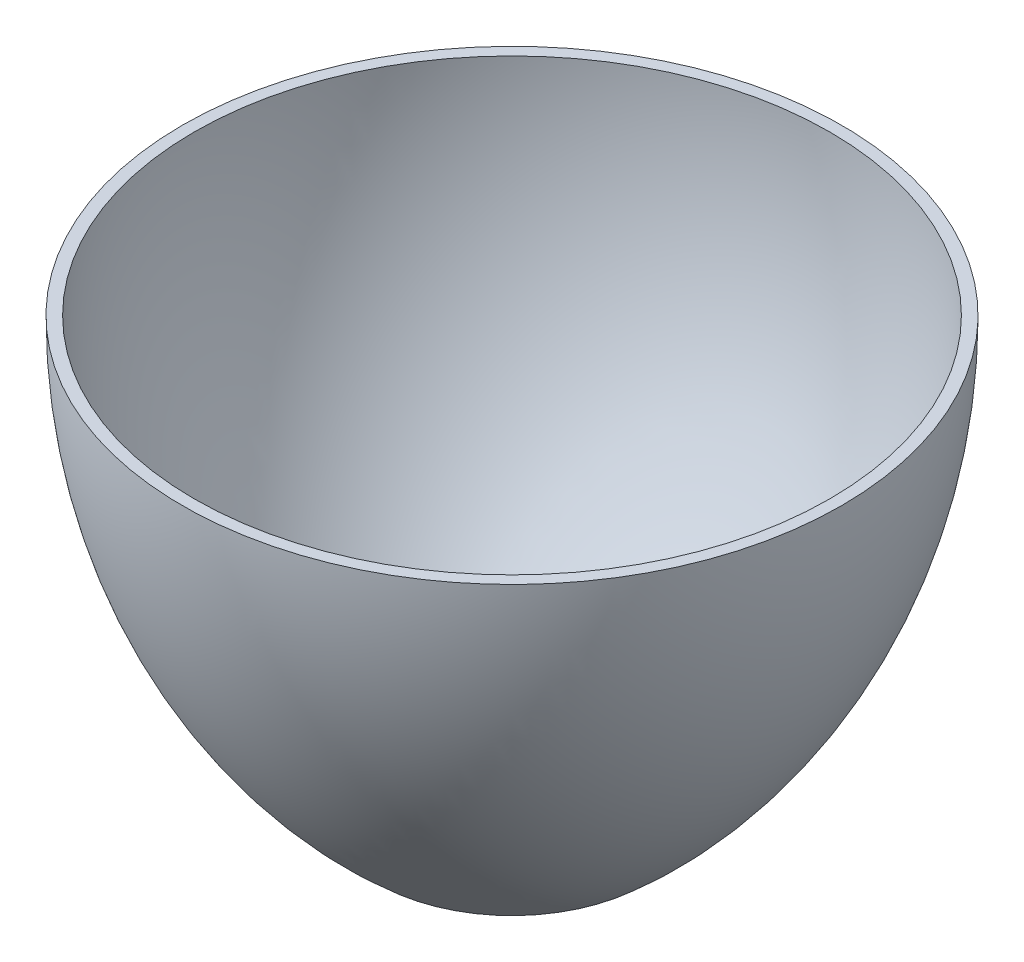
from build123d import *

# Parameters (mm, degrees)
SHELL1_T = 3.175


with BuildPart() as part:
    # Sketch1 → Revolve1 (revolve)
    with BuildSketch(Plane.XY, mode=Mode.PRIVATE) as revolve1_sk:
        with BuildLine():
            ThreePointArc((85.725, 0), (71.552743637, -63.201642829), (31.75, -114.3))
            Line((31.75, -114.3), (0, -114.3))
            Line((0, -114.3), (0, 0))
            Line((0, 0), (85.725, 0))
        make_face()
    revolve(revolve1_sk.sketch.rotate(Axis((0, 0, 0), (0, -1, 0)), 180), axis=Axis((0, 0, 0), (0, -1, 0)))

    # Shell1
    shell1_openings = [part.faces().sort_by_distance(p)[0] for p in [
        (0, 0, 0),
        (0, -114.3, 0),
    ]]
    offset(amount=SHELL1_T, openings=shell1_openings, kind=Kind.INTERSECTION)


solid = part.part
